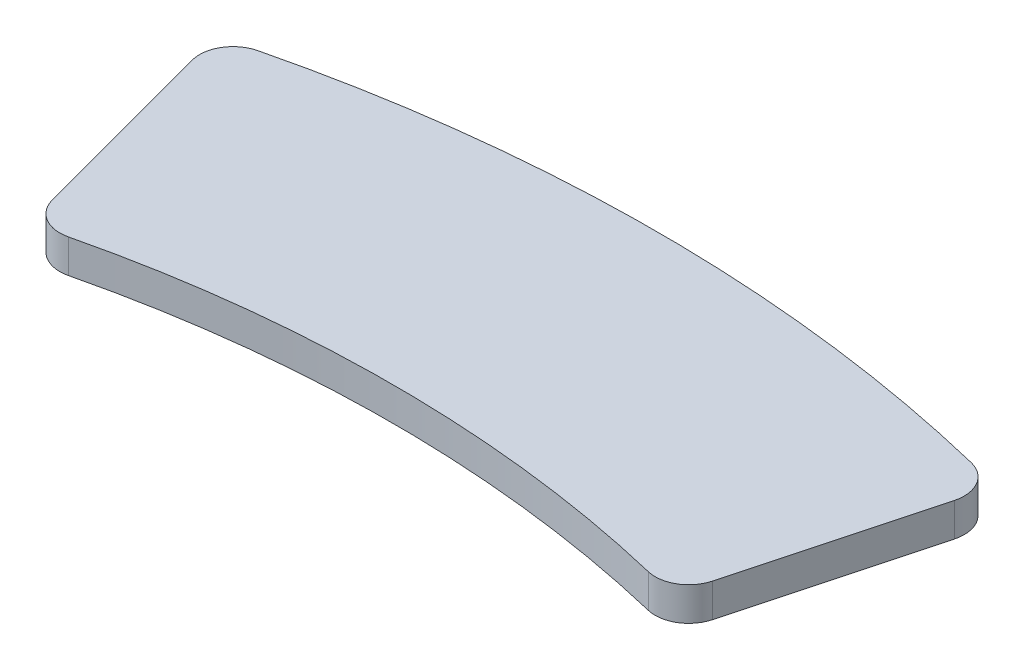
from build123d import *

# Parameters (mm, degrees)
BOSS_EXTRUDE1_DEPTH = 2
FILLET1_R           = 2


with BuildPart() as part:
    # Sketch1 → Boss-Extrude1 (new body)
    with BuildSketch(Plane(origin=(0, 0, 0), x_dir=(1, 0, 0), z_dir=(0, 1, 0))):
        with BuildLine():
            Line((-23.293714059, 86.933324366), (-19.204373147, 71.671696311))
            ThreePointArc((-19.204373147, 71.671696311), (0, 74.2), (19.204373147, 71.671696311))
            Line((19.204373147, 71.671696311), (23.293714059, 86.933324366))
            ThreePointArc((23.293714059, 86.933324366), (0, 90), (-23.293714059, 86.933324366))
        make_face()
    extrude(amount=BOSS_EXTRUDE1_DEPTH)

    # Fillet1
    fillet1_edges = [part.edges().sort_by_distance(p)[0] for p in [
        (23.293714059, 1, -86.933324366),
        (19.204373147, 1, -71.671696311),
        (-19.204373147, 1, -71.671696311),
        (-23.293714059, 1, -86.933324366),
    ]]
    fillet(fillet1_edges, radius=FILLET1_R)


solid = part.part
